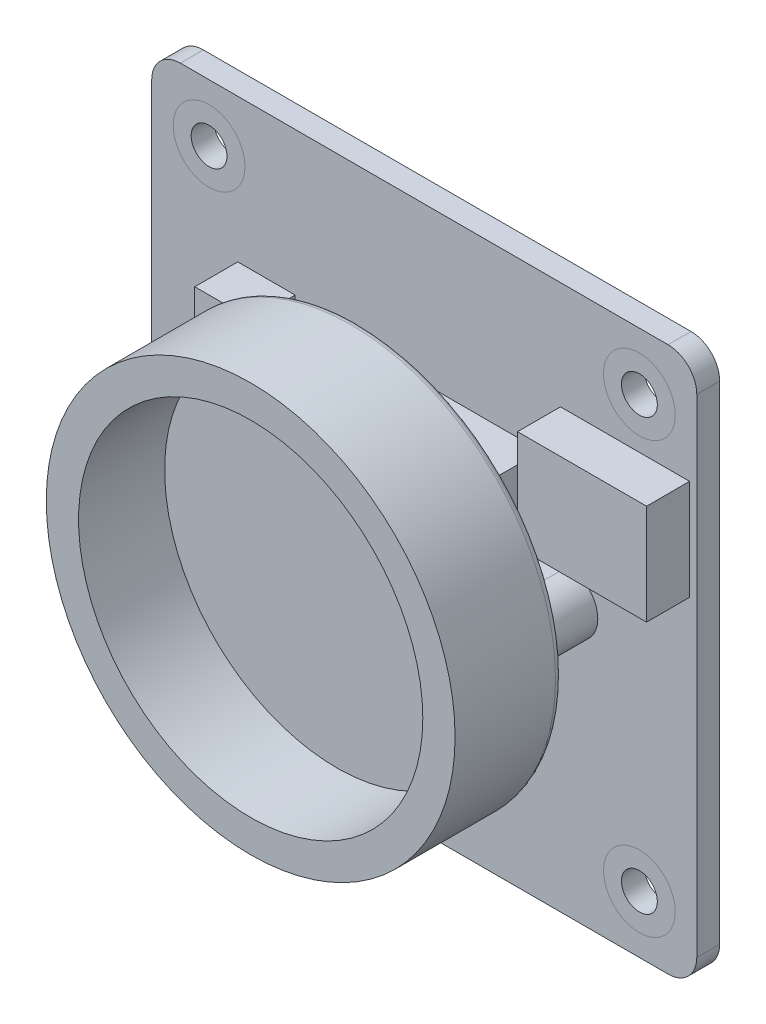
from build123d import *

# Parameters (mm, degrees)
SKETCH1_W             = 38
SKETCH1_H             = 38
BOSS_EXTRUDE1_DEPTH   = 1.6
SKETCH2_R             = 1.25
CUT_EXTRUDE1_DEPTH    = 27.917652201
FILLET1_R             = 2
SKETCH3_R             = 2.1
SKETCH3_W             = 16.3
SKETCH3_H             = 16.3
SKETCH3_W_2           = 20
SKETCH3_H_2           = 4.2
BOSS_EXTRUDE2_DEPTH   = 4.6
SKETCH4_R             = 14.25
BOSS_EXTRUDE3_DEPTH   = 7.5
SKETCH5_R             = 12
CUT_EXTRUDE2_DEPTH    = 6
FILLET2_R             = 0.5
SKETCH6_R             = 1.75
BOSS_EXTRUDE4_DEPTH   = 1
BOSS_EXTRUDE4_2_DEPTH = 1
FILLET3_R             = 0.8
FILLET4_R             = 0.8
SKETCH8_W             = 9
SKETCH8_H             = 7
BOSS_EXTRUDE5_DEPTH   = 3
SKETCH8_W_2           = 4
SKETCH8_H_2           = 6
BOSS_EXTRUDE5_2_DEPTH = 3
BOSS_EXTRUDE5_3_DEPTH = 3


with BuildPart() as part:
    # Sketch1 → Boss-Extrude1 (new body)
    with BuildSketch(Plane.XY):
        Rectangle(SKETCH1_W, SKETCH1_H)
    extrude(amount=BOSS_EXTRUDE1_DEPTH)

    # Sketch2 → Cut-Extrude1 (cut, through all)
    with BuildSketch(Plane.XY.offset(1.6)):
        with Locations((-15, 15)):
            Circle(SKETCH2_R)
        with Locations(Location((15, 15, 0), (0, 0, 180))):
            Circle(SKETCH2_R)
        with Locations((15, -15)):
            Circle(SKETCH2_R)
        with Locations(Location((-15, -15, 0), (0, 0, 180))):
            Circle(SKETCH2_R)
    extrude(amount=-CUT_EXTRUDE1_DEPTH, mode=Mode.SUBTRACT)

    # Fillet1
    fillet1_edges = [part.edges().sort_by_distance(p)[0] for p in [
        (19, -19, 0.8),
        (-19, -19, 0.8),
        (-19, 19, 0.8),
        (19, 19, 0.8),
    ]]
    fillet(fillet1_edges, radius=FILLET1_R)


with BuildPart() as body_2:
    # Sketch3 → Boss-Extrude2 (new body)
    with BuildSketch(Plane.XY.offset(1.6)):
        with Locations((10, 0)):
            Circle(SKETCH3_R)
        with Locations((-10, 0)):
            Circle(SKETCH3_R)
        Rectangle(SKETCH3_W, SKETCH3_H)
        Rectangle(SKETCH3_W_2, SKETCH3_H_2)
    extrude(amount=BOSS_EXTRUDE2_DEPTH)

    # Sketch4 → Boss-Extrude3 (add)
    with BuildSketch(Plane.XY.offset(6.2)):
        Circle(SKETCH4_R)
    extrude(amount=BOSS_EXTRUDE3_DEPTH)

    # Sketch5 → Cut-Extrude2 (cut)
    with BuildSketch(Plane.XY.offset(13.7)):
        Circle(SKETCH5_R)
    extrude(amount=-CUT_EXTRUDE2_DEPTH, mode=Mode.SUBTRACT)

    # Fillet2
    fillet2_edges = [body_2.edges().sort_by_distance(p)[0] for p in [
        (8.15, 2.1, 3.9),
        (8.15, -2.1, 3.9),
        (-8.15, 2.1, 3.9),
        (-8.15, -2.1, 3.9),
        (-14.25, 0, 6.2),
    ]]
    fillet(fillet2_edges, radius=FILLET2_R)


with BuildPart() as body_3:
    # Sketch6 → Boss-Extrude4 (new body)
    with BuildSketch(Plane(origin=(0, 0, 0), x_dir=(-1, 0, 0), z_dir=(0, 0, -1))):
        with Locations((-10, 0)):
            Circle(SKETCH6_R)
    extrude(amount=BOSS_EXTRUDE4_DEPTH)

    # Fillet3
    fillet3_edges = [body_3.edges().sort_by_distance(p)[0] for p in [
        (11.75, 0, -1),
    ]]
    fillet(fillet3_edges, radius=FILLET3_R)


with BuildPart() as body_4:
    # Sketch6 → Boss-Extrude4 2 (new body)
    with BuildSketch(Plane(origin=(0, 0, 0), x_dir=(-1, 0, 0), z_dir=(0, 0, -1))):
        with Locations(Location((10, 0, 0), (0, 0, 180))):
            Circle(SKETCH6_R)
    extrude(amount=BOSS_EXTRUDE4_2_DEPTH)

    # Fillet4
    fillet4_edges = [body_4.edges().sort_by_distance(p)[0] for p in [
        (-11.75, 0, -1),
    ]]
    fillet(fillet4_edges, radius=FILLET4_R)


with BuildPart() as body_5:
    # Sketch8 → Boss-Extrude5 (new body)
    with BuildSketch(Plane.XY.offset(1.6)):
        with Locations((14, 8)):
            Rectangle(SKETCH8_W, SKETCH8_H)
    extrude(amount=BOSS_EXTRUDE5_DEPTH)


with BuildPart() as body_6:
    # Sketch8 → Boss-Extrude5 2 (new body)
    with BuildSketch(Plane.XY.offset(1.6)):
        with Locations((-11, 6)):
            Rectangle(SKETCH8_W_2, SKETCH8_H_2)
    extrude(amount=BOSS_EXTRUDE5_2_DEPTH)


with BuildPart() as body_7:
    # Sketch8 → Boss-Extrude5 3 (new body)
    with BuildSketch(Plane.XY.offset(1.6)):
        with Locations((-11, -6)):
            Rectangle(SKETCH8_W_2, SKETCH8_H_2)
    extrude(amount=BOSS_EXTRUDE5_3_DEPTH)


solid = Compound([part.part, body_2.part, body_3.part, body_4.part, body_5.part, body_6.part, body_7.part])
